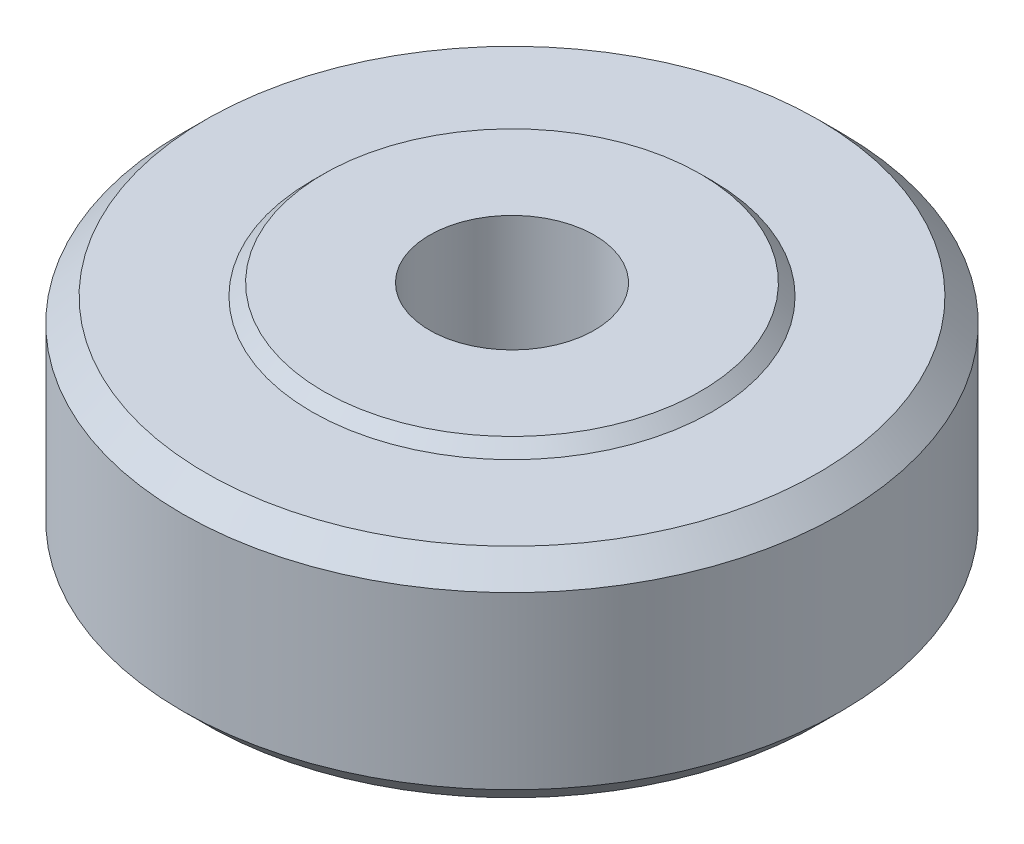
from build123d import *


with BuildPart() as part:
    # Esquisse1 → Révolution1 (revolve)
    with BuildSketch(Plane.XY, mode=Mode.PRIVATE) as r_volution1_sk:
        Polygon((7, 10.25), (7, -10.25), (16, -10.25), (17, -9.25), (26, -9.25), (28, -7.25), (28, 7.25), (26, 9.25), (17, 9.25), (16, 10.25), align=None)
    revolve(r_volution1_sk.sketch.rotate(Axis((0, 0, 0), (0, 1, 0)), 90), axis=Axis((0, 0, 0), (0, 1, 0)))


solid = part.part
